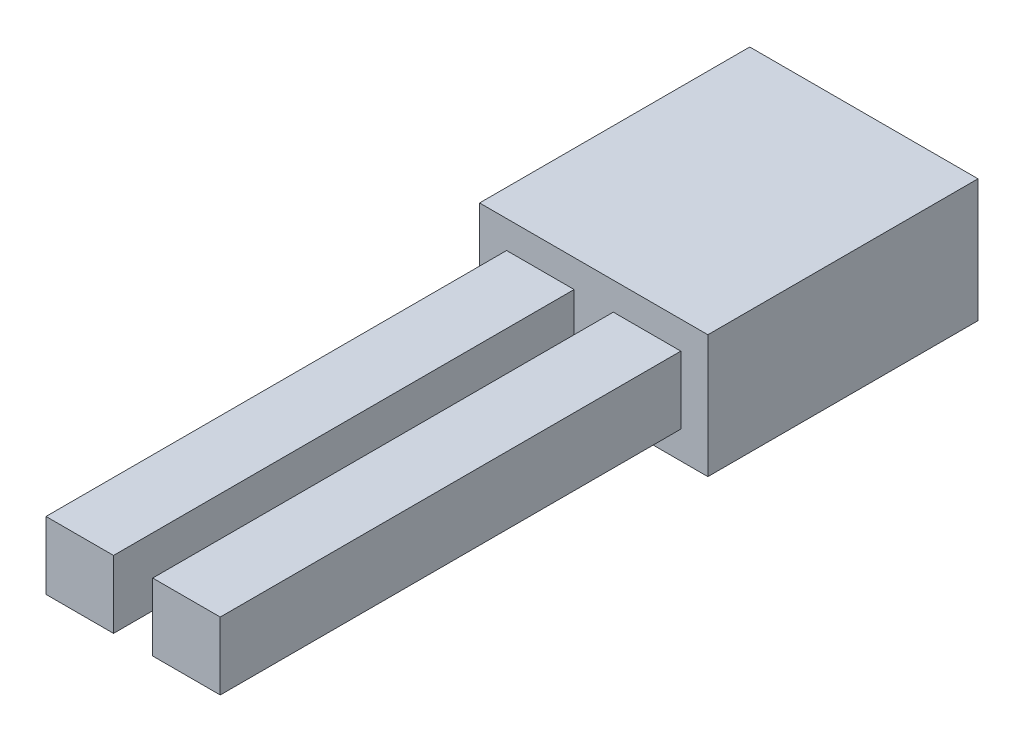
from build123d import *

# Parameters (mm, degrees)
SKETCH1_W           = 3.38
SKETCH1_H           = 4
BOSS_EXTRUDE1_DEPTH = 1.82
SKETCH2_W           = 1
SKETCH2_H           = 1
BOSS_EXTRUDE2_DEPTH = 6.82


with BuildPart() as part:
    # Sketch1 → Boss-Extrude1 (new body)
    with BuildSketch(Plane(origin=(0, 0, 0), x_dir=(1, 0, 0), z_dir=(0, 1, 0))):
        with Locations((1.69, 2)):
            Rectangle(SKETCH1_W, SKETCH1_H)
    extrude(amount=BOSS_EXTRUDE1_DEPTH)

    # Sketch2 → Boss-Extrude2 (add)
    with BuildSketch(Plane.XY):
        with Locations((0.9, 0.91)):
            Rectangle(SKETCH2_W, SKETCH2_H)
        with Locations((2.48, 0.91)):
            Rectangle(SKETCH2_W, SKETCH2_H)
    extrude(amount=BOSS_EXTRUDE2_DEPTH)


solid = part.part
